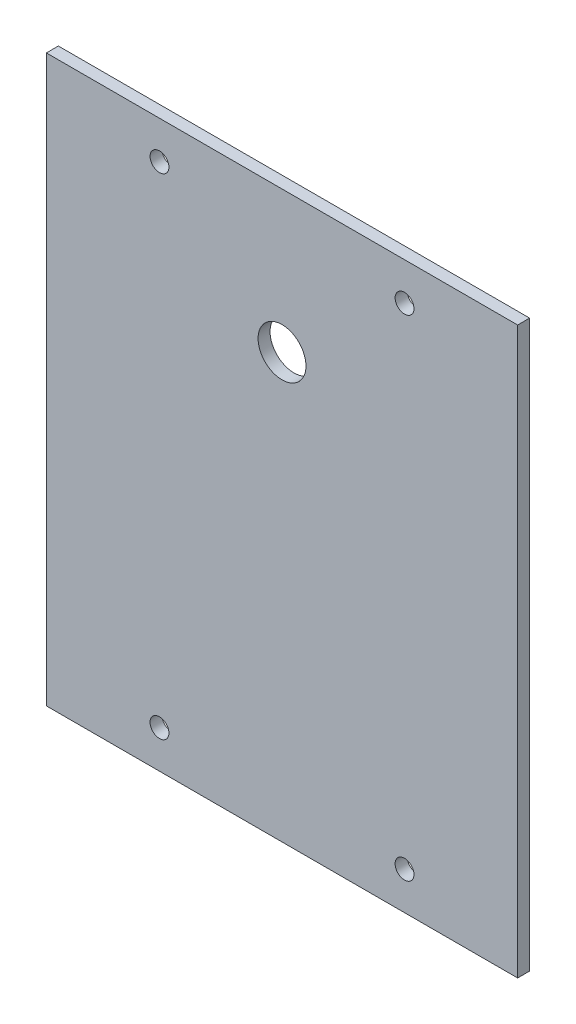
from build123d import *

# Parameters (mm, degrees)
SKETCH1_W           = 125
SKETCH1_H           = 150
BOSS_EXTRUDE1_DEPTH = 3.175
SKETCH2_R           = 2.5
CUT_EXTRUDE1_DEPTH  = 3.175
SKETCH3_R           = 6.35
CUT_EXTRUDE2_DEPTH  = 3.175


with BuildPart() as part:
    # Sketch1 → Boss-Extrude1 (new body)
    with BuildSketch(Plane.XY):
        with Locations((-62.5, 75)):
            Rectangle(SKETCH1_W, SKETCH1_H)
    extrude(amount=BOSS_EXTRUDE1_DEPTH)

    # Sketch2 → Cut-Extrude1 (cut)
    with BuildSketch(Plane.XY.offset(3.175)):
        with Locations((-95, 140)):
            Circle(SKETCH2_R)
        with Locations((-30, 140)):
            Circle(SKETCH2_R)
    cut_extrude1 = extrude(amount=-CUT_EXTRUDE1_DEPTH, mode=Mode.SUBTRACT)

    # Mirror1: Cut-Extrude1 across plane
    add(cut_extrude1.mirror(Plane.ZX.offset(75)), mode=Mode.SUBTRACT)

    # Sketch3 → Cut-Extrude2 (cut)
    with BuildSketch(Plane.XY.offset(3.175)):
        with Locations((-62.5, 112.5)):
            Circle(SKETCH3_R)
    extrude(amount=-CUT_EXTRUDE2_DEPTH, mode=Mode.SUBTRACT)


solid = part.part
